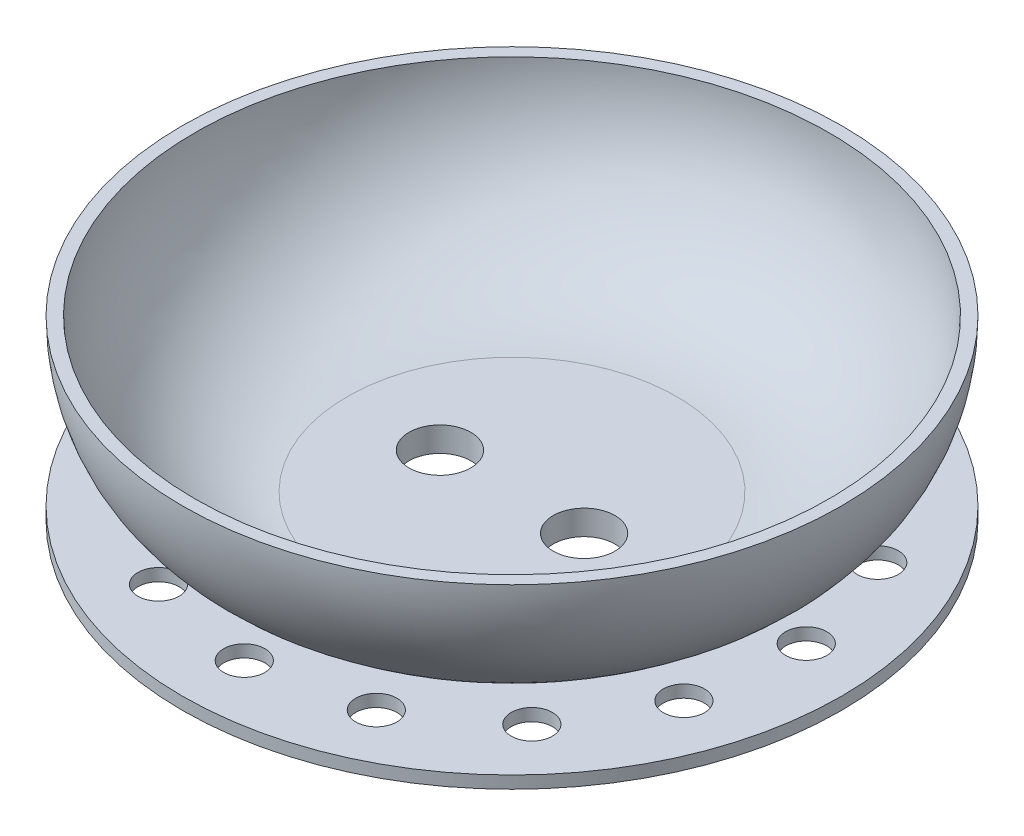
from build123d import *

# Parameters (mm, degrees)
SKETCH2_R           = 101.6
BOSS_EXTRUDE1_DEPTH = 3.81
SKETCH3_R           = 6.35
CUT_EXTRUDE1_DEPTH  = 3.81
CIRPATTERN1_COUNT   = 15
SKETCH5_R           = 9.525
CUT_EXTRUDE3_DEPTH  = 152.172683214


with BuildPart() as part:
    # Sketch1 → Revolve1 (revolve)
    with BuildSketch(Plane.XY, mode=Mode.PRIVATE) as revolve1_sk:
        with BuildLine():
            Line((0, 0), (50.8, 0))
            ThreePointArc((50.8, 0), (86.721024484, 14.878975516), (101.6, 50.8))
            Line((101.6, 50.8), (97.79, 50.8))
            ThreePointArc((97.79, 50.8), (84.026947648, 17.573052352), (50.8, 3.81))
            Line((50.8, 3.81), (0, 3.81))
            Line((0, 3.81), (0, 0))
        make_face()
    revolve(revolve1_sk.sketch.rotate(Axis((0, 25.4, 0), (0, -1, 0)), 90), axis=Axis((0, 25.4, 0), (0, -1, 0)))

    # Sketch2 → Boss-Extrude1 (add)
    with BuildSketch(Plane.XZ):
        with Locations(Location((0, 0, 0), (0, 0, 90))):
            Circle(SKETCH2_R)
    extrude(amount=BOSS_EXTRUDE1_DEPTH)

    # Sketch3 → Cut-Extrude1 (cut)
    with BuildSketch(Plane.XZ.offset(3.81)):
        with Locations(Location((0, 82.55, 0), (0, 0, 270))):
            Circle(SKETCH3_R)
    cut_extrude1 = extrude(amount=-CUT_EXTRUDE1_DEPTH, mode=Mode.SUBTRACT)

    # CirPattern1: Cut-Extrude1 ×15 about axis
    cirpattern1_axis = Axis((0, 0, 0), (0, 1, 0))
    for i in range(1, CIRPATTERN1_COUNT):
        add(cut_extrude1.rotate(cirpattern1_axis, i * 360 / CIRPATTERN1_COUNT), mode=Mode.SUBTRACT)

    # Sketch5 → Cut-Extrude3 (cut, through all)
    with BuildSketch(Plane(origin=(0, 3.81, 0), x_dir=(1, 0, 0), z_dir=(0, 1, 0))):
        with Locations(Location((22.225, 0, 0), (0, 0, 270))):
            Circle(SKETCH5_R)
        with Locations(Location((-22.225, 0, 0), (0, 0, 270))):
            Circle(SKETCH5_R)
    extrude(amount=-CUT_EXTRUDE3_DEPTH, mode=Mode.SUBTRACT)


solid = part.part
